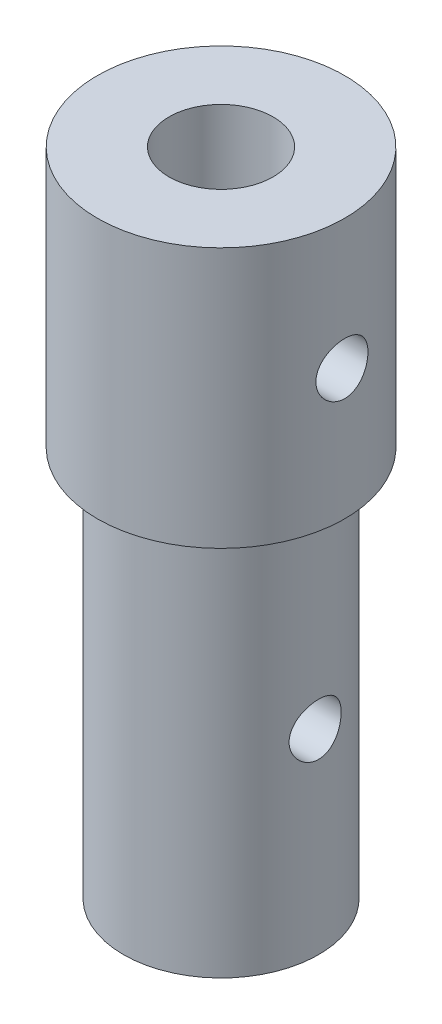
from build123d import *

# Parameters (mm, degrees)
SKETCH1_R           = 7.5
SKETCH1_R_2         = 2.5
BOSS_EXTRUDE1_DEPTH = 22
SKETCH2_R           = 7.5
BOSS_EXTRUDE2_DEPTH = 8
SKETCH3_R           = 9.5
BOSS_EXTRUDE3_DEPTH = 20
SKETCH5_R           = 4
CUT_EXTRUDE1_DEPTH  = 15
SKETCH6_R           = 2
CUT_EXTRUDE2_DEPTH  = 17


with BuildPart() as part:
    # Sketch1 → Boss-Extrude1 (new body)
    with BuildSketch(Plane(origin=(0, 0, 0), x_dir=(1, 0, 0), z_dir=(0, 1, 0))):
        with Locations(Location((0, 0, 0), (0, 0, 270))):
            Circle(SKETCH1_R)
        with Locations(Location((0, 0, 0), (0, 0, 270))):
            Circle(SKETCH1_R_2, mode=Mode.SUBTRACT)
    extrude(amount=BOSS_EXTRUDE1_DEPTH)

    # Sketch2 → Boss-Extrude2 (add)
    with BuildSketch(Plane(origin=(0, 22, 0), x_dir=(1, 0, 0), z_dir=(0, 1, 0))):
        with Locations(Location((0, 0, 0), (0, 0, 270))):
            Circle(SKETCH2_R)
    extrude(amount=BOSS_EXTRUDE2_DEPTH)

    # Sketch3 → Boss-Extrude3 (add)
    with BuildSketch(Plane(origin=(0, 30, 0), x_dir=(1, 0, 0), z_dir=(0, 1, 0))):
        with Locations(Location((0, 0, 0), (0, 0, 270))):
            Circle(SKETCH3_R)
    extrude(amount=BOSS_EXTRUDE3_DEPTH)

    # Sketch5 → Cut-Extrude1 (cut)
    with BuildSketch(Plane(origin=(0, 50, 0), x_dir=(1, 0, 0), z_dir=(0, 1, 0))):
        with Locations(Location((0, 0, 0), (0, 0, 270))):
            Circle(SKETCH5_R)
    extrude(amount=-CUT_EXTRUDE1_DEPTH, mode=Mode.SUBTRACT)

    # Sketch6 → Cut-Extrude2 (cut)
    with BuildSketch(Plane(origin=(0, 0, 0), x_dir=(0, 0, -1), z_dir=(1, 0, 0))):
        with Locations(Location((0, 15, 0), (0, 0, 180))):
            Circle(SKETCH6_R)
        with Locations(Location((0, 40, 0), (0, 0, 180))):
            Circle(SKETCH6_R)
    extrude(amount=CUT_EXTRUDE2_DEPTH, mode=Mode.SUBTRACT)


solid = part.part
